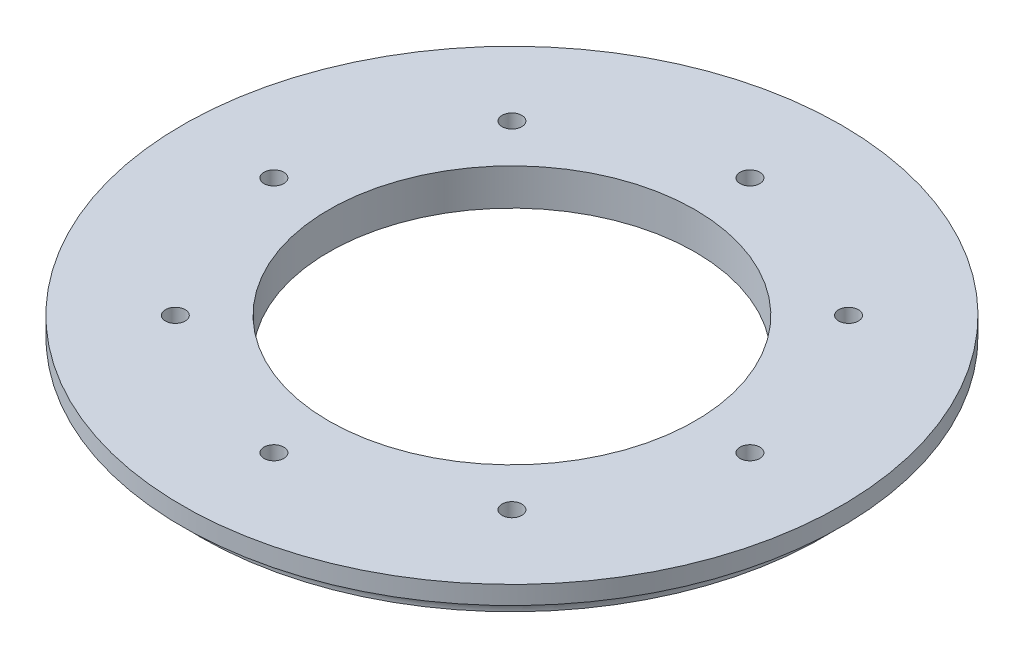
from build123d import *

# Parameters (mm, degrees)
SKETCH2_R          = 1.35
CUT_EXTRUDE1_DEPTH = 64.835726674
SKETCH4_R          = 25
CUT_EXTRUDE2_DEPTH = 64.835726674


with BuildPart() as part:
    # Sketch1 → Revolve1 (revolve)
    with BuildSketch(Plane.XY, mode=Mode.PRIVATE) as revolve1_sk:
        with BuildLine():
            Line((-42.5, 0), (0, 0))
            Line((0, 0), (0, 5))
            Line((0, 5), (-45, 5))
            Line((-45, 5), (-45, 2.5))
            ThreePointArc((-45, 2.5), (-43.232233047, 1.767766953), (-42.5, 0))
        make_face()
    revolve(revolve1_sk.sketch.rotate(Axis((0, 0, 0), (0, 1, 0)), 270), axis=Axis((0, 0, 0), (0, 1, 0)))

    # Sketch2 → Cut-Extrude1 (cut, through all)
    with BuildSketch(Plane(origin=(0, 5, 0), x_dir=(1, 0, 0), z_dir=(0, 1, 0))):
        with Locations(Location((0, 32.5, 0), (0, 0, 270))):
            Circle(SKETCH2_R)
        with Locations(Location((22.980970389, 22.980970389, 0), (0, 0, 270))):
            Circle(SKETCH2_R)
        with Locations(Location((32.5, 0, 0), (0, 0, 270))):
            Circle(SKETCH2_R)
        with Locations(Location((22.980970389, -22.980970389, 0), (0, 0, 270))):
            Circle(SKETCH2_R)
        with Locations(Location((0, -32.5, 0), (0, 0, 270))):
            Circle(SKETCH2_R)
        with Locations(Location((-22.980970389, -22.980970389, 0), (0, 0, 270))):
            Circle(SKETCH2_R)
        with Locations(Location((-32.5, 0, 0), (0, 0, 270))):
            Circle(SKETCH2_R)
        with Locations(Location((-22.980970389, 22.980970389, 0), (0, 0, 270))):
            Circle(SKETCH2_R)
    extrude(amount=-CUT_EXTRUDE1_DEPTH, mode=Mode.SUBTRACT)

    # Sketch4 → Cut-Extrude2 (cut, through all)
    with BuildSketch(Plane(origin=(0, 5, 0), x_dir=(1, 0, 0), z_dir=(0, 1, 0))):
        with Locations(Location((0, 0, 0), (0, 0, 270))):
            Circle(SKETCH4_R)
    extrude(amount=-CUT_EXTRUDE2_DEPTH, mode=Mode.SUBTRACT)


solid = part.part
